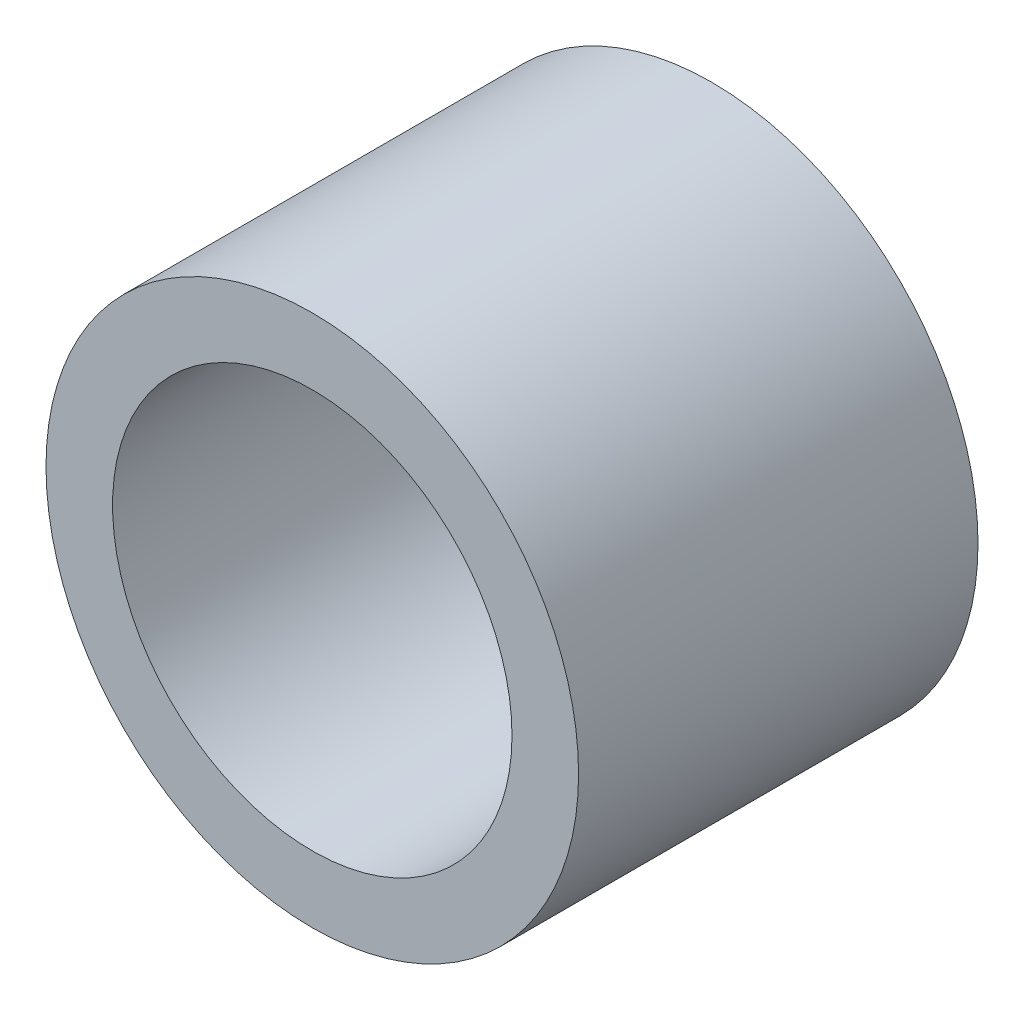
from build123d import *

# Parameters (mm, degrees)
SKETCH1_W = 19.05
SKETCH1_H = 3.175


with BuildPart() as part:
    # Sketch1 → Revolve1 (revolve)
    with BuildSketch(Plane(origin=(0, 0, 0), x_dir=(0, 0, -1), z_dir=(1, 0, 0)), mode=Mode.PRIVATE) as revolve1_sk:
        with Locations((9.525, 11.1125)):
            Rectangle(SKETCH1_W, SKETCH1_H)
    revolve(revolve1_sk.sketch.rotate(Axis((0, 0, 23.204938272), (0, 0, -1)), 90), axis=Axis((0, 0, 23.204938272), (0, 0, -1)))


solid = part.part
